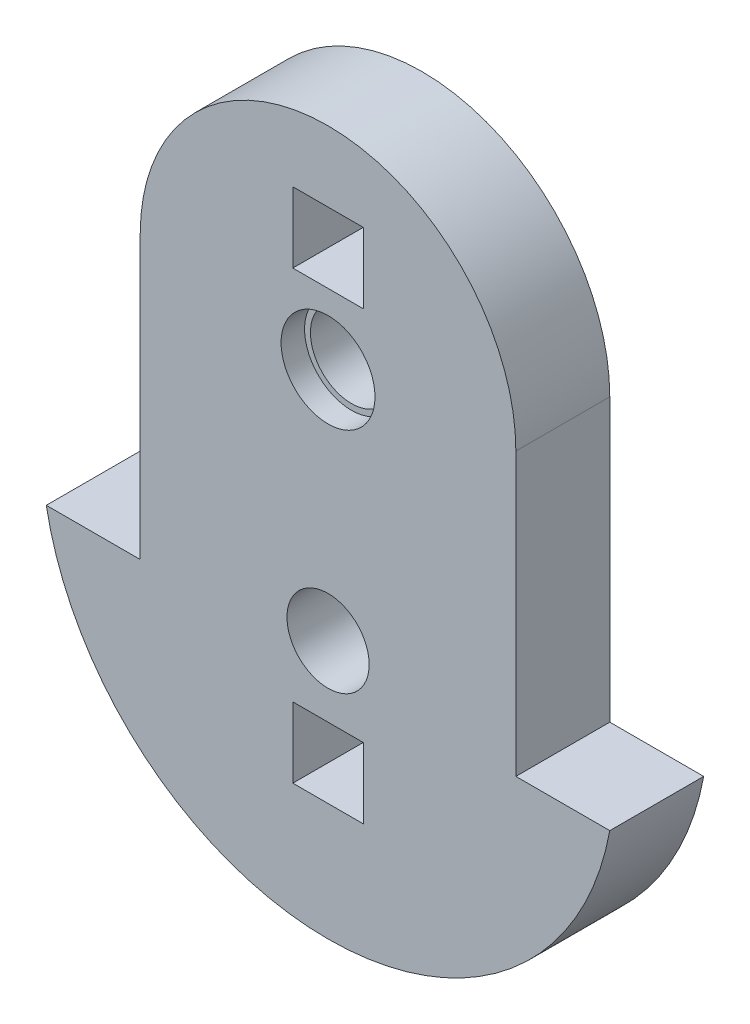
from build123d import *

# Parameters (mm, degrees)
SKETCH1_R           = 1.75
BOSS_EXTRUDE1_DEPTH = 4
SKETCH2_W           = 3
SKETCH2_H           = 3
CUT_EXTRUDE1_DEPTH  = 21.396078054
SKETCH3_R           = 2
CUT_EXTRUDE2_DEPTH  = 1


with BuildPart() as part:
    # Sketch1 → Boss-Extrude1 (new body)
    with BuildSketch(Plane.XY):
        with BuildLine():
            Line((-8, 6), (-8, -6))
            Line((-8, -6), (-12, -6))
            ThreePointArc((-12, -6), (0, -16), (12, -6))
            Line((12, -6), (8, -6))
            Line((8, -6), (8, 6))
            ThreePointArc((8, 6), (0, 14), (-8, 6))
        make_face()
        with Locations((0, 5)):
            Circle(SKETCH1_R, mode=Mode.SUBTRACT)
        with Locations((0, -5)):
            Circle(SKETCH1_R, mode=Mode.SUBTRACT)
    extrude(amount=BOSS_EXTRUDE1_DEPTH)

    # Sketch2 → Cut-Extrude1 (cut, through all)
    with BuildSketch(Plane.XY.offset(4)):
        with Locations((0, 9.5)):
            Rectangle(SKETCH2_W, SKETCH2_H)
        with Locations((0, -9.5)):
            Rectangle(SKETCH2_W, SKETCH2_H)
    extrude(amount=-CUT_EXTRUDE1_DEPTH, mode=Mode.SUBTRACT)

    # Sketch3 → Cut-Extrude2 (cut)
    with BuildSketch(Plane.XY.offset(4)):
        with Locations((0, 5)):
            Circle(SKETCH3_R)
    extrude(amount=-CUT_EXTRUDE2_DEPTH, mode=Mode.SUBTRACT)


solid = part.part
